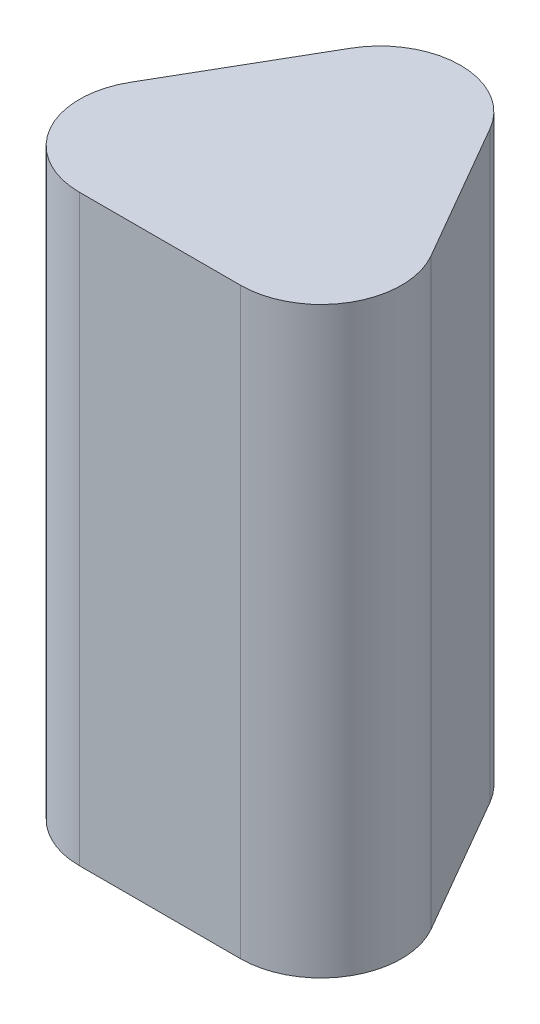
from build123d import *

# Parameters (mm, degrees)
BOSS_EXTRUDE2_DEPTH = 67


with BuildPart() as part:
    # Sketch3 → Boss-Extrude2 (new body)
    with BuildSketch(Plane(origin=(0, 0, 0), x_dir=(1, 0, 0), z_dir=(0, 1, 0))):
        with BuildLine():
            Line((-9.25, -34.52146997), (9.25, -34.52146997))
            ThreePointArc((9.25, -34.52146997), (17.260734985, -29.89646997), (17.260734985, -20.64646997))
            Line((17.260734985, -20.64646997), (8.010734985, -4.625))
            ThreePointArc((8.010734985, -4.625), (0, 0), (-8.010734985, -4.625))
            Line((-8.010734985, -4.625), (-17.260734985, -20.64646997))
            ThreePointArc((-17.260734985, -20.64646997), (-17.260734985, -29.89646997), (-9.25, -34.52146997))
        make_face()
    extrude(amount=BOSS_EXTRUDE2_DEPTH)


solid = part.part
